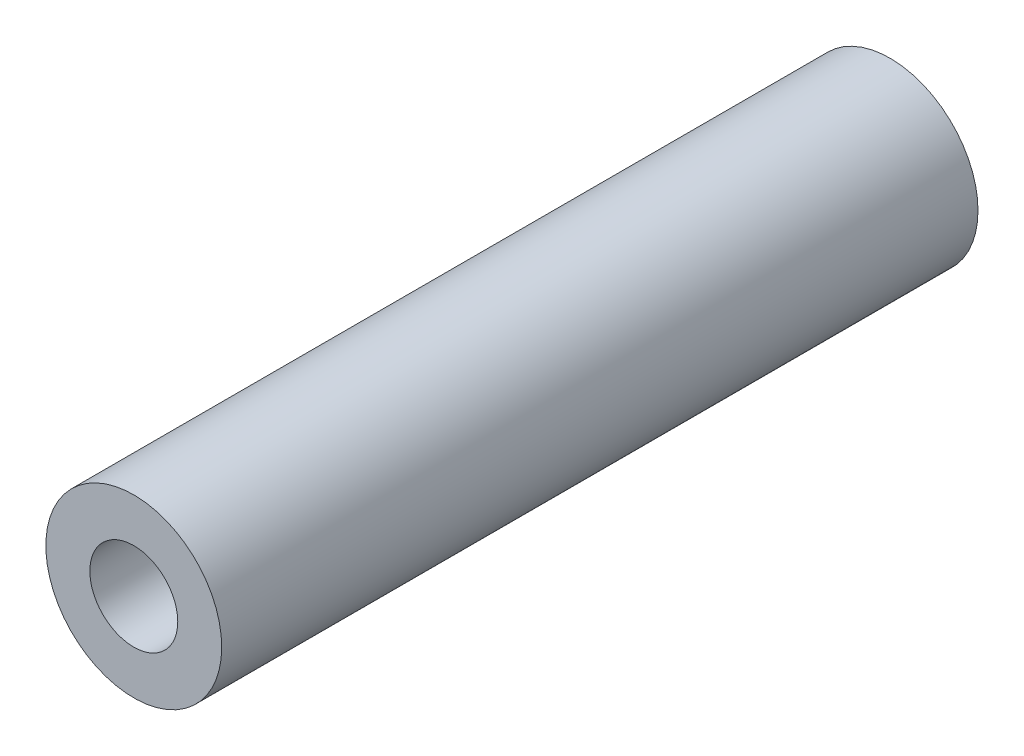
from build123d import *

# Parameters (mm, degrees)
SKETCH1_R           = 5
BOSS_EXTRUDE1_DEPTH = 43
SKETCH2_R           = 2.5
CUT_EXTRUDE1_DEPTH  = 40


with BuildPart() as part:
    # Sketch1 → Boss-Extrude1 (new body)
    with BuildSketch(Plane.XY):
        Circle(SKETCH1_R)
    extrude(amount=BOSS_EXTRUDE1_DEPTH)

    # Sketch2 → Cut-Extrude1 (cut)
    with BuildSketch(Plane.XY.offset(43)):
        Circle(SKETCH2_R)
    extrude(amount=-CUT_EXTRUDE1_DEPTH, mode=Mode.SUBTRACT)


solid = part.part
